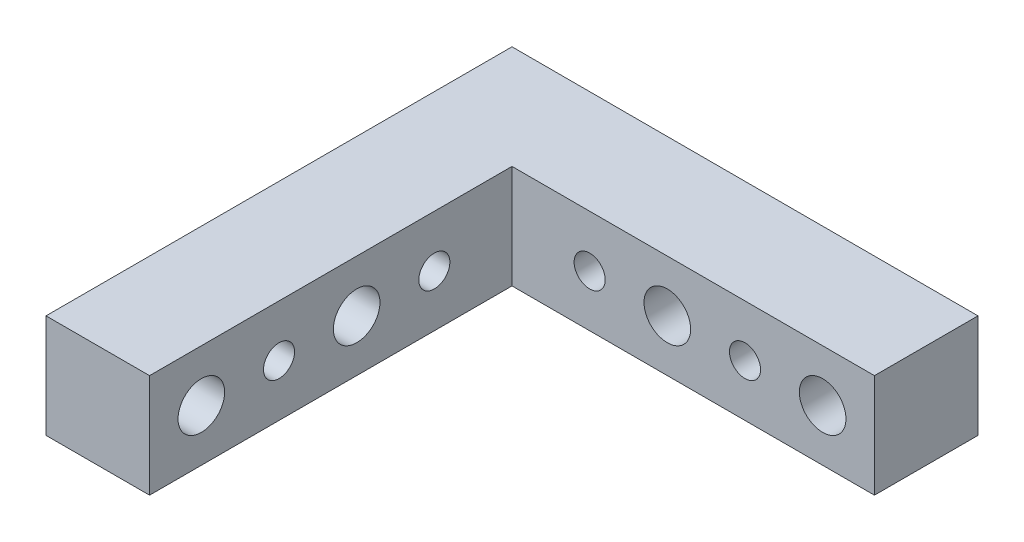
from build123d import *

# Parameters (mm, degrees)
EXTRUDE_1_DEPTH     = 20
SKETCH_2_R          = 3
SKETCH_2_R_2        = 4.5
CUT_EXTRUDE_1_DEPTH = 20
SKETCH_3_R          = 3
SKETCH_3_R_2        = 4.5
CUT_EXTRUDE_2_DEPTH = 20


with BuildPart() as part:
    # 草图1 → 凸台-拉伸1 (new body)
    with BuildSketch(Plane(origin=(0, 0, 0), x_dir=(1, 0, 0), z_dir=(0, 1, 0))):
        Polygon((0, 0), (0, -90), (20, -90), (20, -20), (90, -20), (90, 0), align=None)
    extrude(amount=EXTRUDE_1_DEPTH)

    # 草图2 → 切除-拉伸1 (cut)
    with BuildSketch(Plane.ZY):
        with Locations((35, 10)):
            Circle(SKETCH_2_R)
        with Locations((50, 10)):
            Circle(SKETCH_2_R_2)
        with Locations((65, 10)):
            Circle(SKETCH_2_R)
        with Locations((80, 10)):
            Circle(SKETCH_2_R_2)
    extrude(amount=-CUT_EXTRUDE_1_DEPTH, mode=Mode.SUBTRACT)

    # 草图3 → 切除-拉伸2 (cut)
    with BuildSketch(Plane(origin=(0, 0, 0), x_dir=(-1, 0, 0), z_dir=(0, 0, -1))):
        with Locations((-35, 10)):
            Circle(SKETCH_3_R)
        with Locations((-50, 10)):
            Circle(SKETCH_3_R_2)
        with Locations((-65, 10)):
            Circle(SKETCH_3_R)
        with Locations((-80, 10)):
            Circle(SKETCH_3_R_2)
    extrude(amount=-CUT_EXTRUDE_2_DEPTH, mode=Mode.SUBTRACT)


solid = part.part
